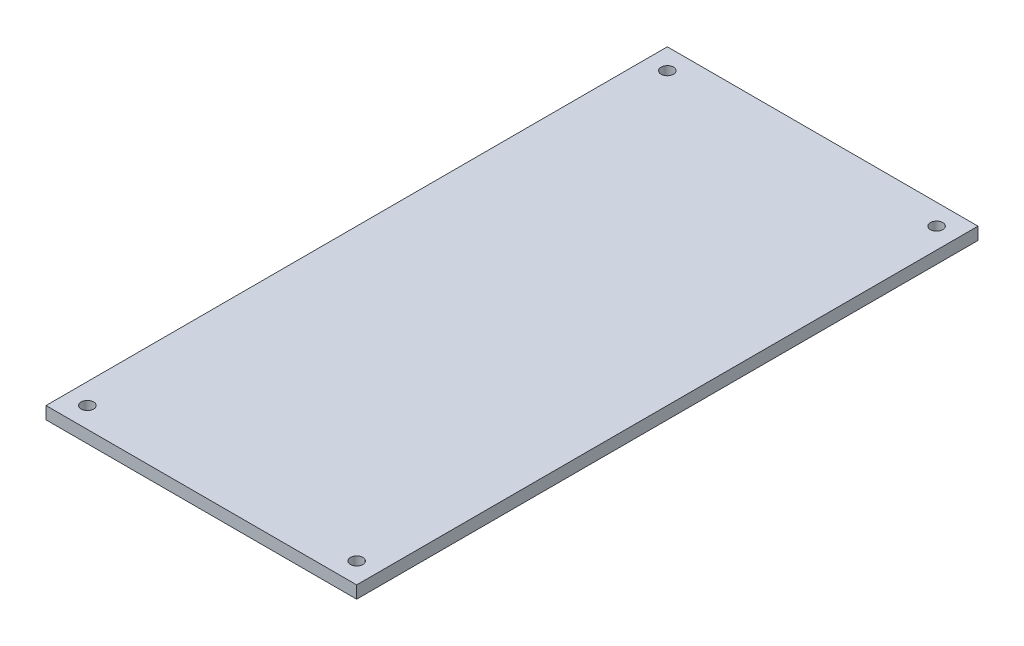
from build123d import *

# Parameters (mm, degrees)
SKETCH1_W           = 75
SKETCH1_H           = 150
BOSS_EXTRUDE1_DEPTH = 3
SKETCH2_R           = 1.5
CUT_EXTRUDE1_DEPTH  = 20


with BuildPart() as part:
    # Sketch1 → Boss-Extrude1 (new body)
    with BuildSketch(Plane(origin=(0, 0, 0), x_dir=(1, 0, 0), z_dir=(0, 1, 0))):
        with Locations((-12.5, 25)):
            Rectangle(SKETCH1_W, SKETCH1_H)
    extrude(amount=BOSS_EXTRUDE1_DEPTH)

    # Sketch2 → Cut-Extrude1 (cut)
    with BuildSketch(Plane(origin=(0, 3, 0), x_dir=(1, 0, 0), z_dir=(0, 1, 0))):
        with Locations(Location((-45, 95, 0), (0, 0, 270))):
            Circle(SKETCH2_R)
        with Locations(Location((20, 95, 0), (0, 0, 270))):
            Circle(SKETCH2_R)
        with Locations(Location((20, -45, 0), (0, 0, 270))):
            Circle(SKETCH2_R)
        with Locations(Location((-45, -45, 0), (0, 0, 270))):
            Circle(SKETCH2_R)
    extrude(amount=-CUT_EXTRUDE1_DEPTH, mode=Mode.SUBTRACT)


solid = part.part
